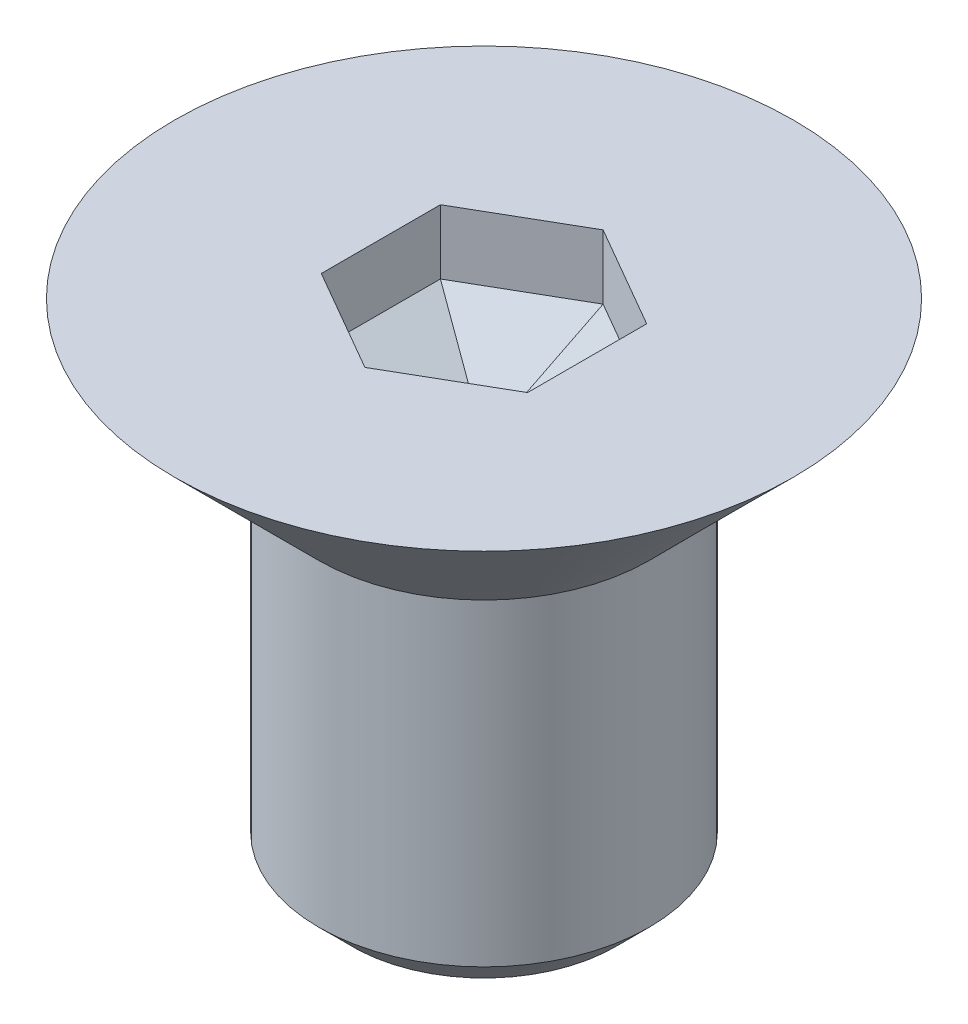
from build123d import *
from OCP.BRepFilletAPI import BRepFilletAPI_MakeChamfer

# Parameters (mm, degrees)
SKETCH_4_R          = 2
EXTRUDE_2_DEPTH     = 6
CUT_EXTRUDE_1_DEPTH = 1.5
CHAMFER_3_SIZE      = 0.720461095
CHAMFER_3_SIZE2     = 1.247875222
CHAMFER_4_SIZE      = 0.4


with BuildPart() as part:
    # 草图2 → 旋转1 (revolve)
    with BuildSketch(Plane.XY):
        Polygon((0, -2.48), (0, 0), (3.75, 0), (1.27, -2.48), align=None)
    revolve(axis=Axis((0, -2.48, 0), (0, 1, 0)))

    # 草图4 → 凸台-拉伸2 (add)
    with BuildSketch(Plane.XZ):
        Circle(SKETCH_4_R)
    extrude(amount=EXTRUDE_2_DEPTH)

    # 草图3 → 切除-拉伸1 (cut)
    with BuildSketch(Plane(origin=(0, 0, 0), x_dir=(1, 0, 0), z_dir=(0, 1, 0))):
        Polygon((1.25, 0.721687836), (0, 1.443375673), (-1.25, 0.721687836), (-1.25, -0.721687836), (0, -1.443375673), (1.25, -0.721687836), align=None)
    extrude(amount=-CUT_EXTRUDE_1_DEPTH, mode=Mode.SUBTRACT)

    # 倒角3: one chamfer whose edges measure the first distance from different faces: ONE call of the kernel's chamfer builder (chamfer() names one face for all edges)
    chamfer_3_edges_1 = [part.edges().sort_by_distance(p)[0] for p in [
        (-0.625, -1.5, 1.082531755),
    ]]
    chamfer_3_side_1 = [part.faces().sort_by_distance(p)[0] for p in [
        (-0.625, -0.75, 1.082531755),
    ]]
    chamfer_3_edges_2 = [part.edges().sort_by_distance(p)[0] for p in [
        (-1.25, -1.5, 0),
    ]]
    chamfer_3_side_2 = [part.faces().sort_by_distance(p)[0] for p in [
        (-1.25, -0.75, 0),
    ]]
    chamfer_3_edges_3 = [part.edges().sort_by_distance(p)[0] for p in [
        (-0.625, -1.5, -1.082531755),
    ]]
    chamfer_3_side_3 = [part.faces().sort_by_distance(p)[0] for p in [
        (-0.625, -0.75, -1.082531755),
    ]]
    chamfer_3_edges_4 = [part.edges().sort_by_distance(p)[0] for p in [
        (0.625, -1.5, -1.082531755),
    ]]
    chamfer_3_side_4 = [part.faces().sort_by_distance(p)[0] for p in [
        (0.625, -0.75, -1.082531755),
    ]]
    chamfer_3_edges_5 = [part.edges().sort_by_distance(p)[0] for p in [
        (1.25, -1.5, 0),
    ]]
    chamfer_3_side_5 = [part.faces().sort_by_distance(p)[0] for p in [
        (1.25, -0.75, 0),
    ]]
    chamfer_3_edges_6 = [part.edges().sort_by_distance(p)[0] for p in [
        (0.625, -1.5, 1.082531755),
    ]]
    chamfer_3_side_6 = [part.faces().sort_by_distance(p)[0] for p in [
        (0.625, -0.75, 1.082531755),
    ]]
    chamfer_3 = BRepFilletAPI_MakeChamfer(part.part.solid().wrapped)
    for e in chamfer_3_edges_1:
        chamfer_3.Add(CHAMFER_3_SIZE, CHAMFER_3_SIZE2, e.wrapped, chamfer_3_side_1[0].wrapped)  # the first distance lies on this face
    for e in chamfer_3_edges_2:
        chamfer_3.Add(CHAMFER_3_SIZE, CHAMFER_3_SIZE2, e.wrapped, chamfer_3_side_2[0].wrapped)  # the first distance lies on this face
    for e in chamfer_3_edges_3:
        chamfer_3.Add(CHAMFER_3_SIZE, CHAMFER_3_SIZE2, e.wrapped, chamfer_3_side_3[0].wrapped)  # the first distance lies on this face
    for e in chamfer_3_edges_4:
        chamfer_3.Add(CHAMFER_3_SIZE, CHAMFER_3_SIZE2, e.wrapped, chamfer_3_side_4[0].wrapped)  # the first distance lies on this face
    for e in chamfer_3_edges_5:
        chamfer_3.Add(CHAMFER_3_SIZE, CHAMFER_3_SIZE2, e.wrapped, chamfer_3_side_5[0].wrapped)  # the first distance lies on this face
    for e in chamfer_3_edges_6:
        chamfer_3.Add(CHAMFER_3_SIZE, CHAMFER_3_SIZE2, e.wrapped, chamfer_3_side_6[0].wrapped)  # the first distance lies on this face
    add(Compound.cast(chamfer_3.Shape()), mode=Mode.REPLACE)

    # 倒角4
    chamfer_4_edges = [part.edges().sort_by_distance(p)[0] for p in [
        (-2, -6, 0),
    ]]
    chamfer(chamfer_4_edges, length=CHAMFER_4_SIZE)


solid = part.part
